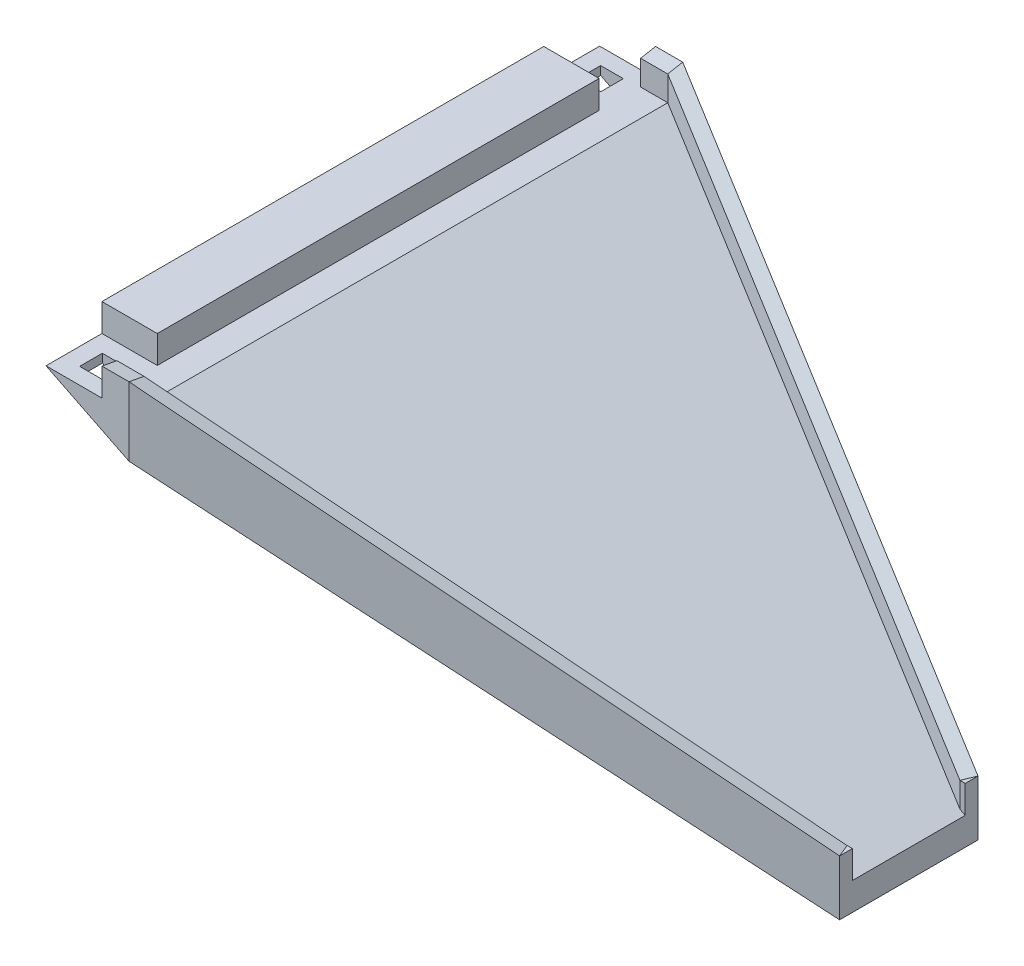
from build123d import *

# Parameters (mm, degrees)
SALIENTE_EXTRUIR1_DEPTH  = 200
CROQUIS2_W               = 8.2
CROQUIS2_H               = 8.2
CORTAR_EXTRUIR1_DEPTH    = 200
CORTAR_EXTRUIR3_DEPTH    = 313.49262378
SALIENTE_EXTRUIR3_DEPTH  = 5
SALIENTE_EXTRUIR4_REACH  = 313.287
CROQUIS10_W              = 4.621603975
CROQUIS10_H              = 10
CROQUIS11_W              = 20
CROQUIS11_H              = 159.6
SALIENTE_EXTRUIR6_DEPTH  = 10
CORTAR_EXTRUIR4_DEPTH    = 313.49262378
SALIENTE_EXTRUIR10_REACH = 299.92


with BuildPart() as part:
    # Croquis1 → Saliente-Extruir1 (new body)
    with BuildSketch(Plane.XY):
        Polygon((4.273004903, 100), (215.932026149, -5), (215.932026149, 5), (34.273004903, 100), align=None)
    extrude(amount=SALIENTE_EXTRUIR1_DEPTH)

    # Croquis2 → Cortar-Extruir1 (cut)
    with BuildSketch(Plane(origin=(0, 100, 0), x_dir=(1, 0, 0), z_dir=(0, 1, 0))):
        with Locations((14.623004903, -10)):
            Rectangle(CROQUIS2_W, CROQUIS2_H)
    cortar_extruir1 = extrude(amount=-CORTAR_EXTRUIR1_DEPTH, mode=Mode.SUBTRACT)

    # Croquis8 → Cortar-Extruir3 (cut, through all)
    with BuildSketch(Plane(origin=(0, 100, 0), x_dir=(1, 0, 0), z_dir=(0, 1, 0))):
        Polygon((34.273004903, -200), (215.932026149, -200), (215.932026149, -125), align=None)
        Polygon((215.932026149, -75), (215.932026149, 0), (34.273004903, 0), align=None)
    extrude(amount=-CORTAR_EXTRUIR3_DEPTH, mode=Mode.SUBTRACT)

    # Croquis9 → Saliente-Extruir3 (add)
    with BuildSketch(Plane(origin=(4.991214306, 0, -12.08932141), x_dir=(-0.9243207949834489, 0, -0.3816163884860884), z_dir=(0.38161638848608836, 0, -0.9243207949834488))):
        Polygon((-228.211691209, 5), (-228.211691209, 15), (-31.679251139, 110), (-31.679251139, 100), align=None)
    saliente_extruir3 = extrude(amount=-SALIENTE_EXTRUIR3_DEPTH)

    # Simetría2: Saliente-Extruir3 across plane
    add(saliente_extruir3.mirror(Plane.XY.offset(100)))

    # Croquis10 → Saliente-Extruir4 (add, up to next)
    with BuildSketch(Plane(origin=(215.932026149, 0, 0), x_dir=(0, 0, -1), z_dir=(1, 0, 0)), mode=Mode.PRIVATE) as saliente_extruir4_sk1:
        with Locations((-122.689198013, 10)):
            Rectangle(CROQUIS10_W, CROQUIS10_H)
    saliente_extruir4_tool1 = extrude(saliente_extruir4_sk1.sketch, amount=-SALIENTE_EXTRUIR4_REACH, mode=Mode.PRIVATE) - part.part
    # Croquis10 → Saliente-Extruir4 (add, up to next)
    with BuildSketch(Plane(origin=(215.932026149, 0, 0), x_dir=(0, 0, -1), z_dir=(1, 0, 0)), mode=Mode.PRIVATE) as saliente_extruir4_sk2:
        with Locations((-77.310801987, 10)):
            Rectangle(CROQUIS10_W, CROQUIS10_H)
    saliente_extruir4_tool2 = extrude(saliente_extruir4_sk2.sketch, amount=-SALIENTE_EXTRUIR4_REACH, mode=Mode.PRIVATE) - part.part
    add(saliente_extruir4_tool1.solids().sort_by_distance((215.932026, 10, 122.689198))[0])
    add(saliente_extruir4_tool2.solids().sort_by_distance((215.932026, 10, 77.310802))[0])

    # Croquis11 → Saliente-Extruir6 (add)
    with BuildSketch(Plane(origin=(0, 100, 0), x_dir=(1, 0, 0), z_dir=(0, 1, 0))):
        with Locations((14.273004903, -100)):
            Rectangle(CROQUIS11_W, CROQUIS11_H)
    extrude(amount=SALIENTE_EXTRUIR6_DEPTH)

    # Croquis12 → Cortar-Extruir4 (cut, through all)
    with BuildSketch(Plane(origin=(0, 100, 0), x_dir=(1, 0, 0), z_dir=(0, 1, 0))):
        Polygon((34.273004903, -200), (34.273004903, -194.59062262), (32.364922961, -195.378396025), align=None)
    cortar_extruir4 = extrude(amount=CORTAR_EXTRUIR4_DEPTH, mode=Mode.SUBTRACT)

    # Simetría3: Cortar-Extruir4 across plane
    add(cortar_extruir4.mirror(Plane.XY.offset(100)), mode=Mode.SUBTRACT)

    # Simetría5: Cortar-Extruir1 across plane
    add(cortar_extruir1.mirror(Plane.XY.offset(100)), mode=Mode.SUBTRACT)

    # Croquis17 → Saliente-Extruir10 (add, up to next)
    with BuildSketch(Plane.ZY.offset(-24.473004903), mode=Mode.PRIVATE) as saliente_extruir10_sk1:
        Polygon((194.59062262, 109.002153687), (194.59062262, 100), (200, 100), (200, 110), align=None)
    saliente_extruir10_tool1 = extrude(saliente_extruir10_sk1.sketch, amount=-SALIENTE_EXTRUIR10_REACH, mode=Mode.PRIVATE) - part.part
    saliente_extruir10 = saliente_extruir10_tool1.solids().sort_by_distance((24.473005, 104.754905, 197.342654))[0]
    add(saliente_extruir10)

    # Simetría6: Saliente-Extruir10 across plane
    add(saliente_extruir10.mirror(Plane.XY.offset(100)))


solid = part.part
